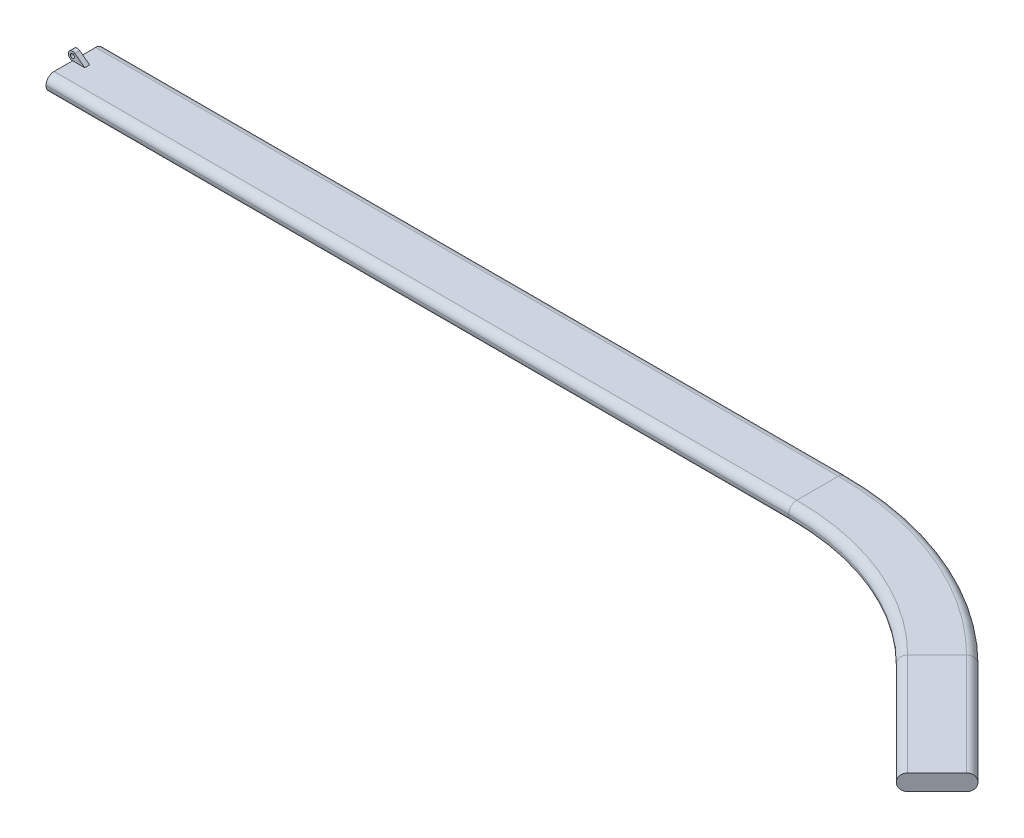
from build123d import *

# Parameters (mm, degrees)
SKETCH3_W           = 7
SKETCH3_H           = 1.97
FILLET1_R           = 0.98
SKETCH7_R           = 0.25
BOSS_EXTRUDE1_DEPTH = 0.6


with BuildPart() as part:
    # Sweep1: sweep along a path in Sketch1
    with BuildLine(Plane(origin=(0, 0, 0), x_dir=(1, 0, 0), z_dir=(0, 1, 0))) as sweep1_path:
        Line((0, 0), (90, 0))
        ThreePointArc((90, 0), (103.393920133, -2.664216362), (114.748737342, -10.251262658))
        Line((114.748737342, -10.251262658), (127.13092964, -22.633454957))
    # Sketch3 → Sweep1 (sweep)
    with BuildSketch(Plane(origin=(0, 0, 0), x_dir=(0, 0, -1), z_dir=(1, 0, 0))):
        Rectangle(SKETCH3_W, SKETCH3_H)
    sweep(path=sweep1_path.line)

    # Fillet1
    fillet1_edges = [part.edges().sort_by_distance(p)[0] for p in [
        (45, -0.985, -3.5),
        (45, 0.985, -3.5),
        (45, 0.985, 3.5),
        (45, -0.985, 3.5),
        (104.733312146, -0.985, -0.569362002),
        (104.733312146, 0.985, -0.569362002),
        (102.05452812, 0.985, 5.897794726),
        (102.05452812, -0.985, 5.897794726),
        (123.414707225, -0.985, 13.967485074),
        (123.414707225, 0.985, 13.967485074),
        (118.464959757, 0.985, 18.917232542),
        (118.464959757, -0.985, 18.917232542),
    ]]
    fillet(fillet1_edges, radius=FILLET1_R)


with BuildPart() as body_2:
    # Sketch7 → Boss-Extrude1 (new body)
    with BuildSketch(Plane.XY.offset(0.3)):
        with BuildLine():
            Line((1.487306111, 1.005), (0, 1.005))
            ThreePointArc((0, 1.005), (-0.473935601, 1.664326852), (0.30204267, 1.903459817))
            Line((0.30204267, 1.903459817), (1.487306111, 1.005))
        make_face()
        with Locations((0, 1.505)):
            Circle(SKETCH7_R, mode=Mode.SUBTRACT)
    extrude(amount=-BOSS_EXTRUDE1_DEPTH)


solid = Compound([part.part, body_2.part])
